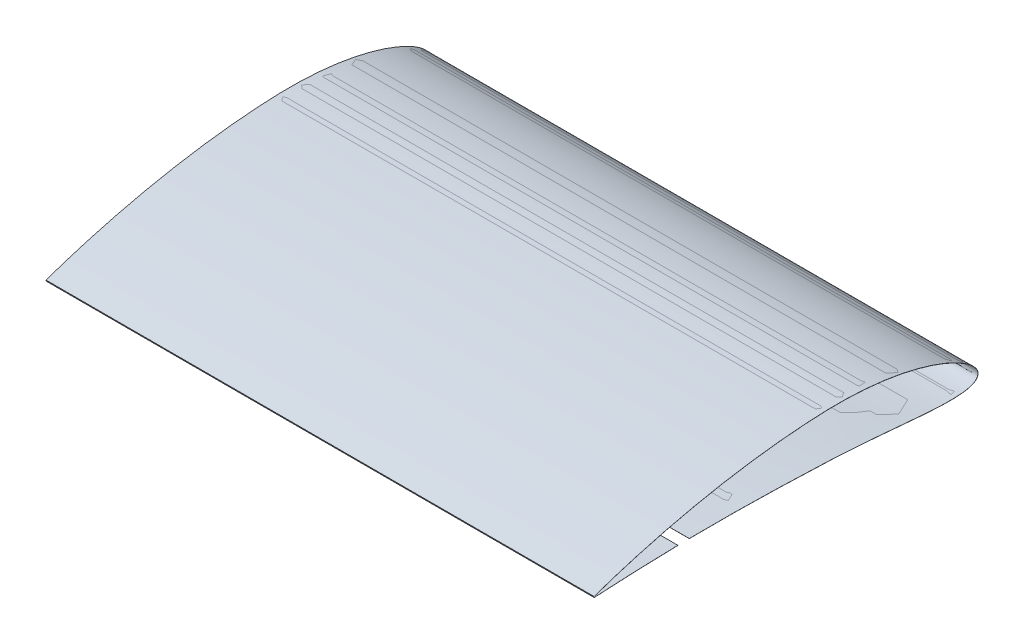
from build123d import *

# Parameters (mm, degrees)
BOSS_EXTRUDE1_DEPTH      = 254
BOSS_EXTRUDE1_DEPTH_BACK = 254
CUT_EXTRUDE1_DEPTH       = 439.541591567
CUT_EXTRUDE1_DEPTH_BACK  = 439.541591567


with BuildPart() as part:
    # Sketch1 → Boss-Extrude1 (new, two sides: drawn at the far end of the back side and taken through both)
    with BuildSketch(Plane(origin=(0, 0, 0), x_dir=(0, 0, -1), z_dir=(1, 0, 0)).offset(-BOSS_EXTRUDE1_DEPTH_BACK)):
        with BuildLine():
            Line((-354.886743617, -0.043132144), (-354.99149892, 0.476454159))
            add(Edge.make_bspline(
                [(-354.99149892, 0.476454159), (-347.783593071, 2.959720022), (-333.311697469, 7.76743875), (-304.078052973, 16.464991966), (-267.096515494, 25.774786648), (-229.639462396, 32.944545613), (-199.450230249, 37.301190717), (-176.714275569, 39.827183694), (-153.906158518, 41.58647891), (-131.03977612, 42.479842921), (-108.154229955, 41.863767742), (-89.168120213, 39.979475533), (-74.098856377, 37.594417698), (-62.881435173, 35.331879377), (-51.7773445, 32.562006126), (-40.824113666, 29.240494899), (-31.867581604, 25.954413067), (-24.850887862, 22.951954032), (-19.685642534, 20.484382266), (-14.645467459, 17.767522296), (-9.77578942, 14.742035882), (-5.946772155, 11.874879811), (-3.140632771, 9.269412602), (-1.24439325, 7.100121216), (0.080172615, 5.059059621), (0.734728016, 3.225404373), (0.959702576, 1.749644514), (0.852938138, 0.273348057), (0.143098613, -1.559511436), (-1.577222389, -3.417578203), (-4.142703198, -4.776298794), (-6.885121223, -5.694029747), (-9.681876117, -6.330501065), (-13.458760778, -6.919755633), (-18.220322024, -7.307987073), (-23.94144297, -7.464251794), (-29.662456321, -7.409321836), (-35.379234273, -7.211608771), (-41.090605222, -6.912227315), (-48.699082932, -6.414379812), (-58.199146289, -5.657863194), (-69.590216516, -4.65595538), (-80.978589908, -3.630054837), (-92.368874257, -2.627816782), (-107.56313892, -1.375441372), (-126.573365315, -0.048864739), (-145.613201917, 0.757519293), (-160.850436225, 1.274697119), (-176.087168981, 1.801353096), (-195.136294848, 2.345387362), (-218.000758012, 2.779371126), (-237.05701774, 2.925569666), (-252.302341579, 2.896860798), (-263.73597927, 2.802520029), (-275.168693373, 2.637956293), (-286.600178358, 2.391728354), (-296.124627961, 2.123723762), (-303.742775876, 1.877302738), (-309.456624125, 1.672578754), (-315.170675094, 1.447330006), (-320.881449306, 1.206811952), (-326.586197896, 0.954928725), (-331.352247356, 0.714636978), (-335.168021523, 0.511580202), (-338.020999346, 0.36724993), (-340.852436227, 0.246984365), (-343.684829351, 0.118397327), (-346.099213672, -0.068340914), (-348.057709576, -0.249421829), (-349.49515544, -0.343114156), (-350.641754644, -0.345792204), (-351.509080841, -0.291364997), (-352.169529456, -0.275148661), (-352.878616179, -0.32484418), (-353.534718925, -0.45936157), (-354.133565705, -0.643391605), (-354.471117086, -0.699431405), (-354.718790465, -0.620573956), (-354.877800433, -0.392167923), (-354.878804645, -0.178279335), (-354.886743617, -0.043132144)],
                knots=[-0.000119616, -0.000119616, -0.000119616, -0.000119616, 0.031133862, 0.062387339, 0.124894294, 0.187401249, 0.218654727, 0.249908204, 0.281161682, 0.312415159, 0.343668637, 0.374922115, 0.390548853, 0.406175592, 0.421802331, 0.43742907, 0.453055808, 0.460869178, 0.468682547, 0.476495916, 0.484309286, 0.492122655, 0.49602934, 0.499936025, 0.503842709, 0.505796052, 0.507749394, 0.509702736, 0.511656079, 0.515562763, 0.519469448, 0.523376133, 0.527282817, 0.531189502, 0.539002872, 0.546816241, 0.55462961, 0.56244298, 0.570256349, 0.578069718, 0.593696457, 0.609323196, 0.624949935, 0.640576673, 0.656203412, 0.68745689, 0.718710367, 0.734337106, 0.749963845, 0.781217322, 0.8124708, 0.843724277, 0.859351016, 0.874977755, 0.890604494, 0.906231232, 0.921857971, 0.929671341, 0.93748471, 0.945298079, 0.953111449, 0.960924818, 0.968738187, 0.972644872, 0.976551557, 0.980458242, 0.984364926, 0.988271611, 0.990224953, 0.992178296, 0.994131638, 0.995108309, 0.99608498, 0.997061652, 0.998038323, 0.998526658, 0.999014994, 0.999259162, 0.999503329, 0.999991665, 0.999991665, 0.999991665, 0.999991665], degree=3))
        make_face()
        with BuildLine():
            Line((-354.787327228, -0.030257196), (-354.876173011, 0.410417887))
            add(Edge.make_bspline(
                [(-354.876173011, 0.410417887), (-354.559877309, 0.519388), (-353.29965963, 0.95355787), (-350.47872665, 1.927095868), (-345.800950265, 3.497798274), (-336.024074692, 6.721551148), (-319.654473712, 11.798891927), (-300.598349456, 17.130600639), (-282.422876264, 21.724272526), (-261.175777938, 26.651569731), (-238.622276389, 31.145528798), (-208.774809213, 36.004755717), (-183.96165787, 39.090454058), (-158.902335219, 41.113212891), (-140.096691022, 42.111376668), (-121.516747473, 42.228858195), (-103.422167262, 41.321050632), (-86.188408528, 39.478676181), (-70.043450957, 36.810480574), (-55.199760436, 33.432905997), (-41.843390777, 29.510854383), (-30.130463623, 25.220125297), (-20.187014188, 20.73431935), (-12.107203154, 16.226289935), (-5.926897661, 11.855341958), (-1.679224073, 7.716499794), (0.765838065, 3.796757813), (0.987487677, -0.148325216), (-1.35108726, -3.308943186), (-5.450780885, -5.288085739), (-11.087315968, -6.587464624), (-18.34911979, -7.268527656), (-27.163826626, -7.404874951), (-37.447057223, -7.053797092), (-49.083078017, -6.301866785), (-61.95239395, -5.238034817), (-75.929862643, -3.983911698), (-96.406736552, -2.153555858), (-117.937239158, -0.458414508), (-140.484776897, 0.674535203), (-158.296467959, 1.286744043), (-176.48388462, 1.917893193), (-200.671973719, 2.586246563), (-224.541124114, 2.979106232), (-247.830237405, 3.028480659), (-264.337268621, 2.907447598), (-279.933149694, 2.656365926), (-294.437996632, 2.282890374), (-307.681856469, 1.852126627), (-319.513378006, 1.371074809), (-329.767358246, 0.912902227), (-338.388880463, 0.426846955), (-345.076973543, 0.191518705), (-350.227621538, -0.406394891), (-352.780150329, -0.035387827), (-354.744619464, -0.75811662), (-354.777220059, -0.20251155), (-354.787327228, -0.030257196)],
                knots=[0, 0, 0, 0, 0.001371577, 0.005464776, 0.012234802, 0.021601969, 0.04767125, 0.082496261, 0.102719149, 0.124527079, 0.171912573, 0.19697838, 0.248496767, 0.274385101, 0.300041178, 0.325689988, 0.350525088, 0.374279703, 0.396711254, 0.417576734, 0.436654006, 0.45374439, 0.468679994, 0.481329415, 0.491630702, 0.499615789, 0.505546281, 0.510184984, 0.514824194, 0.520701508, 0.52851604, 0.538465752, 0.550542609, 0.564643256, 0.580638139, 0.598344876, 0.617584458, 0.638174401, 0.682632113, 0.706120665, 0.730727383, 0.755700244, 0.780731769, 0.829932396, 0.853570292, 0.876213105, 0.897609987, 0.917519394, 0.935698347, 0.951942678, 0.966047159, 0.97783994, 0.987174002, 0.993931501, 0.998018399, 0.999385644, 1, 1, 1, 1], degree=3))
        make_face(mode=Mode.SUBTRACT)
    extrude(amount=BOSS_EXTRUDE1_DEPTH + BOSS_EXTRUDE1_DEPTH_BACK)

    # Sketch2 → Cut-Extrude1 (cut, two sides: drawn at the far end of the back side and taken through both)
    with BuildSketch(Plane(origin=(0, 0, 0), x_dir=(0, 0, -1), z_dir=(1, 0, 0)).offset(-CUT_EXTRUDE1_DEPTH_BACK)):
        Polygon((-266.7, 25.310988042), (-266.7, -28.097024663), (-291.604565331, -28.097024663), align=None)
    extrude(amount=CUT_EXTRUDE1_DEPTH + CUT_EXTRUDE1_DEPTH_BACK, mode=Mode.SUBTRACT)


solid = part.part
